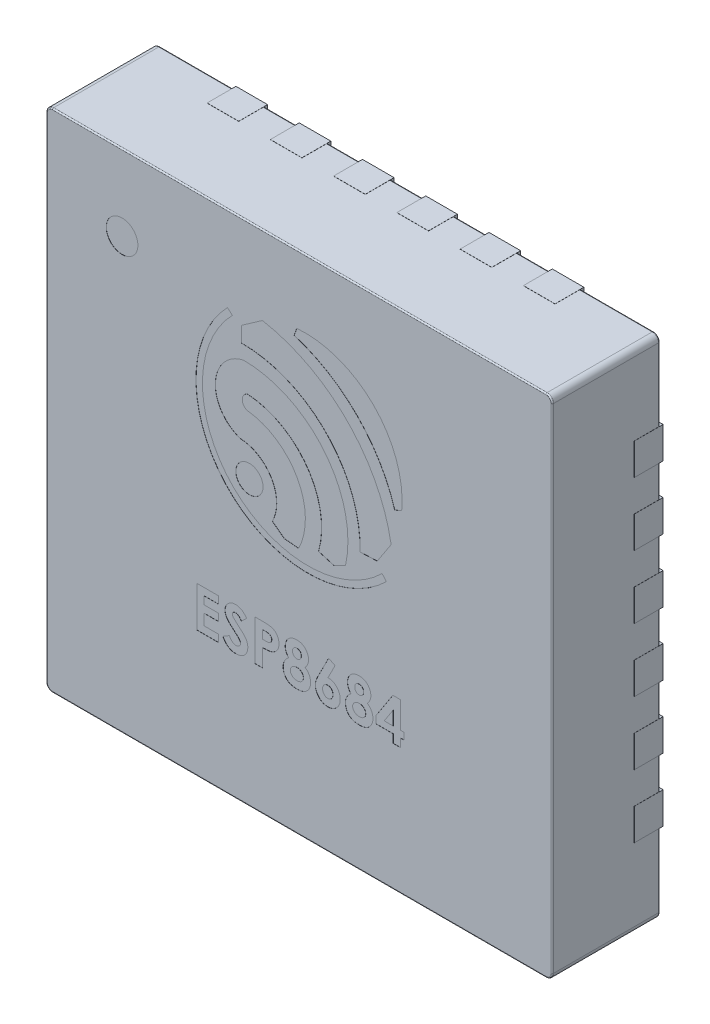
from build123d import *

# Parameters (mm, degrees)
SKETCH1_W                = 4
SKETCH1_H                = 4
BOSS_EXTRUDE1_DEPTH      = 0.85
FILLET1_R                = 0.05
FILLET2_R                = 0.01
BOSS_EXTRUDE2_DEPTH      = 0.025
BOSS_EXTRUDE2_DEPTH_BACK = 0.203
SKETCH2_W                = 0.25
SKETCH2_H                = 0.3
SKETCH2_W_2              = 0.3
SKETCH2_H_2              = 0.25
SKETCH3_R                = 0.125
SKETCH3_R_2              = 0.107472001
CUT_EXTRUDE1_DEPTH       = 0.001
BODY_MOVE_COPY1_ANGLE    = 180


with BuildPart() as part:
    # Sketch1 → Boss-Extrude1 (new body)
    with BuildSketch(Plane(origin=(0, 0, 0), x_dir=(1, 0, 0), z_dir=(0, 1, 0))):
        Rectangle(SKETCH1_W, SKETCH1_H)
    extrude(amount=BOSS_EXTRUDE1_DEPTH)

    # Fillet1
    fillet1_edges = [part.edges().sort_by_distance(p)[0] for p in [
        (2, 0.425, 2),
        (-2, 0.425, 2),
        (-2, 0.425, -2),
        (2, 0.425, -2),
    ]]
    fillet(fillet1_edges, radius=FILLET1_R)

    # Fillet2
    fillet2_edges = [part.edges().sort_by_distance(p)[0] for p in [
        (0, 0, -2),
        (0, 0.85, -2),
        (2, 0, 0),
        (0, 0, 2),
        (-2, 0, 0),
        (-1.985355339, 0, -1.985355339),
        (-1.985355339, 0, 1.985355339),
        (1.985355339, 0, 1.985355339),
        (1.985355339, 0, -1.985355339),
        (2, 0.85, 0),
        (-2, 0.85, 0),
        (0, 0.85, 2),
        (-1.985355339, 0.85, -1.985355339),
        (-1.985355339, 0.85, 1.985355339),
        (1.985355339, 0.85, 1.985355339),
        (1.985355339, 0.85, -1.985355339),
    ]]
    fillet(fillet2_edges, radius=FILLET2_R)

    # Sketch2 → Boss-Extrude2 (add, two sides: drawn at the far end of the back side and taken through both)
    with BuildSketch(Plane.XZ.offset(-BOSS_EXTRUDE2_DEPTH_BACK)):
        with BuildLine():
            Line((1.1, 1.4), (1.4, 1.1))
            Line((1.4, 1.1), (1.4, -1.35))
            ThreePointArc((1.4, -1.35), (1.385355339, -1.385355339), (1.35, -1.4))
            Line((1.35, -1.4), (-1.35, -1.4))
            ThreePointArc((-1.35, -1.4), (-1.385355339, -1.385355339), (-1.4, -1.35))
            Line((-1.4, -1.35), (-1.4, 1.35))
            ThreePointArc((-1.4, 1.35), (-1.385355339, 1.385355339), (-1.35, 1.4))
            Line((-1.35, 1.4), (1.1, 1.4))
        make_face()
        with Locations((-0.25, 1.851)):
            Rectangle(SKETCH2_W, SKETCH2_H)
        with Locations((-0.75, 1.851)):
            Rectangle(SKETCH2_W, SKETCH2_H)
        with Locations((-1.25, 1.851)):
            Rectangle(SKETCH2_W, SKETCH2_H)
        with Locations((1.25, 1.851)):
            Rectangle(SKETCH2_W, SKETCH2_H)
        with Locations((0.75, 1.851)):
            Rectangle(SKETCH2_W, SKETCH2_H)
        with Locations((0.25, 1.851)):
            Rectangle(SKETCH2_W, SKETCH2_H)
        with Locations((0.25, -1.851)):
            Rectangle(SKETCH2_W, SKETCH2_H)
        with Locations((0.75, -1.851)):
            Rectangle(SKETCH2_W, SKETCH2_H)
        with Locations((1.25, -1.851)):
            Rectangle(SKETCH2_W, SKETCH2_H)
        with Locations((-1.25, -1.851)):
            Rectangle(SKETCH2_W, SKETCH2_H)
        with Locations((-0.75, -1.851)):
            Rectangle(SKETCH2_W, SKETCH2_H)
        with Locations((-0.25, -1.851)):
            Rectangle(SKETCH2_W, SKETCH2_H)
        with Locations((1.851, 0.25)):
            Rectangle(SKETCH2_W_2, SKETCH2_H_2)
        with Locations((1.851, 0.75)):
            Rectangle(SKETCH2_W_2, SKETCH2_H_2)
        with Locations((1.851, 1.25)):
            Rectangle(SKETCH2_W_2, SKETCH2_H_2)
        with Locations((1.851, -1.25)):
            Rectangle(SKETCH2_W_2, SKETCH2_H_2)
        with Locations((1.851, -0.75)):
            Rectangle(SKETCH2_W_2, SKETCH2_H_2)
        with Locations((1.851, -0.25)):
            Rectangle(SKETCH2_W_2, SKETCH2_H_2)
        with Locations((-1.851, -0.25)):
            Rectangle(SKETCH2_W_2, SKETCH2_H_2)
        with Locations((-1.851, -0.75)):
            Rectangle(SKETCH2_W_2, SKETCH2_H_2)
        with Locations((-1.851, -1.25)):
            Rectangle(SKETCH2_W_2, SKETCH2_H_2)
        with Locations((-1.851, 1.25)):
            Rectangle(SKETCH2_W_2, SKETCH2_H_2)
        with Locations((-1.851, 0.75)):
            Rectangle(SKETCH2_W_2, SKETCH2_H_2)
        with Locations((-1.851, 0.25)):
            Rectangle(SKETCH2_W_2, SKETCH2_H_2)
    extrude(amount=BOSS_EXTRUDE2_DEPTH + BOSS_EXTRUDE2_DEPTH_BACK)

    # Sketch3 → Cut-Extrude1 (cut)
    # profile 1 of 13: a face of its own
    with BuildSketch(Plane(origin=(0, 0.85, 0), x_dir=(1, 0, 0), z_dir=(0, 1, 0))):
        with Locations(Location((1.4, -1.4, 0), (0, 0, 270))):
            Circle(SKETCH3_R)
    # profile 2 of 13: a face of its own
    with BuildSketch(Plane(origin=(0, 0.85, 0), x_dir=(1, 0, 0), z_dir=(0, 1, 0))):
        with Locations(Location((0.39345508, -0.241141571, 0), (0, 0, 270))):
            Circle(SKETCH3_R_2)
    # profile 3 of 13: a face of its own
    with BuildSketch(Plane(origin=(0, 0.85, 0), x_dir=(1, 0, 0), z_dir=(0, 1, 0))):
        with BuildLine():
            Line((-0.75484892, -0.602812328), (-0.81007292, -0.626332328))
            ThreePointArc((-0.81007292, -0.626332328), (-0.5893237, -1.23600018), (0.019198016, -1.459889505))
            Line((0.019198016, -1.459889505), (0.04024708, -1.401220328))
            ThreePointArc((0.04024708, -1.401220328), (-0.456838845, -1.101141344), (-0.75484892, -0.602812328))
        make_face()
    # profile 4 of 13: a face of its own
    with BuildSketch(Plane(origin=(0, 0.85, 0), x_dir=(1, 0, 0), z_dir=(0, 1, 0))):
        with BuildLine():
            Line((-0.480528921, -0.178899684), (-0.616632921, -0.184731684))
            Line((-0.616632921, -0.184731684), (-0.726624921, -0.352659684))
            ThreePointArc((-0.726624921, -0.352659684), (-0.37936407, -1.025536938), (0.290872644, -1.377867242))
            Line((0.290872644, -1.377867242), (0.455992644, -1.262019242))
            Line((0.455992644, -1.262019242), (0.455992644, -1.140315242))
            ThreePointArc((0.455992644, -1.140315242), (-0.215367273, -0.857447739), (-0.480528921, -0.178899684))
        make_face()
    # profile 5 of 13: a face of its own
    with BuildSketch(Plane(origin=(0, 0.85, 0), x_dir=(1, 0, 0), z_dir=(0, 1, 0))):
        with BuildLine():
            Line((0.52833508, -1.294420328), (0.56680708, -1.328452328))
            ThreePointArc((0.56680708, -1.328452328), (0.554829133, -0.084518675), (-0.689155241, -0.080361643))
            Line((-0.689155241, -0.080361643), (-0.65494165, -0.118677704))
            ThreePointArc((-0.65494165, -0.118677704), (0.518632873, -0.120883837), (0.52833508, -1.294420328))
        make_face()
    # profile 6 of 13: a face of its own
    with BuildSketch(Plane(origin=(0, 0.85, 0), x_dir=(1, 0, 0), z_dir=(0, 1, 0))):
        with BuildLine():
            Line((0.212761002, -0.04284098), (0.118057002, 0.02882302))
            Line((0.118057002, 0.02882302), (0.004345002, 0.03883102))
            ThreePointArc((0.004345002, 0.03883102), (0.014709312, -0.436766768), (0.409873248, -0.701617932))
            ThreePointArc((0.409873248, -0.701617932), (0.450103558, -0.758817334), (0.407750059, -0.814462916))
            ThreePointArc((0.407750059, -0.814462916), (-0.062895806, -0.551053312), (-0.152614131, -0.019223667))
            Line((-0.152614131, -0.019223667), (-0.272806131, 0.016560333))
            Line((-0.272806131, 0.016560333), (-0.366444513, -0.030306803))
            ThreePointArc((-0.366444513, -0.030306803), (-0.20125363, -0.724111429), (0.442201869, -1.031711667))
            ThreePointArc((0.442201869, -1.031711667), (0.66297992, -0.765895236), (0.465792913, -0.482137228))
            ThreePointArc((0.465792913, -0.482137228), (0.218503697, -0.332053753), (0.212761002, -0.04284098))
        make_face()
    # profile 7 of 13: a face of its own
    with BuildSketch(Plane(origin=(0, 0.85, 0), x_dir=(1, 0, 0), z_dir=(0, 1, 0))):
        Polygon((-0.740128205, 0.671794872), (-0.8, 0.671794872), (-0.8, 0.881025641), (-0.828717949, 0.881025641), (-0.828717949, 0.934358974), (-0.8, 0.934358974), (-0.8, 1), (-0.742564103, 1), (-0.742564103, 0.934358974), (-0.607179487, 0.934358974), (-0.607179487, 0.876217949), align=None)
        Polygon((-0.742564103, 0.881025641), (-0.742564103, 0.772115385), (-0.671730769, 0.881025641), align=None, mode=Mode.SUBTRACT)
    # profile 8 of 13: a face of its own
    with BuildSketch(Plane(origin=(0, 0.85, 0), x_dir=(1, 0, 0), z_dir=(0, 1, 0))):
        with BuildLine():
            add(Edge.make_bspline(
                [(-0.538717949, 0.827692308), (-0.542074141, 0.830089455), (-0.548717421, 0.834834392), (-0.557468605, 0.843332909), (-0.565055443, 0.852782462), (-0.571368707, 0.863152349), (-0.576412324, 0.874251167), (-0.579878411, 0.885929587), (-0.582196171, 0.898006919), (-0.582440559, 0.906228445), (-0.582564103, 0.910384615)],
                knots=[0, 0, 0, 0, 1.013470425, 2.00607327, 2.989559212, 3.987547927, 4.985093546, 5.979490292, 6.978585884, 8, 8, 8, 8], degree=3))
            add(Edge.make_bspline(
                [(-0.582564103, 0.910384615), (-0.582412391, 0.914884339), (-0.58211149, 0.923808962), (-0.579444528, 0.936895333), (-0.575185136, 0.949455647), (-0.569309229, 0.961341484), (-0.561975998, 0.972225398), (-0.553478536, 0.981937819), (-0.543690001, 0.990050179), (-0.534649917, 0.995632893), (-0.526814509, 0.999254772), (-0.52054234, 1.0017274), (-0.513811265, 1.003676431), (-0.506733579, 1.005352804), (-0.499235434, 1.006609645), (-0.491390646, 1.007599027), (-0.483125669, 1.008078834), (-0.477500458, 1.008162313), (-0.474615385, 1.008205128)],
                knots=[0, 0, 0, 0, 1.313633616, 2.605423678, 3.884827599, 5.180399172, 6.467003699, 7.709825993, 8.937691468, 10.168030689, 10.802071053, 11.45831639, 12.135866991, 12.84764728, 13.582572811, 14.35620613, 15.156926628, 16, 16, 16, 16], degree=3))
            add(Edge.make_bspline(
                [(-0.474615385, 1.008205128), (-0.471537957, 1.008163148), (-0.465528348, 1.008081169), (-0.456754724, 1.007591525), (-0.448482043, 1.006671374), (-0.440672822, 1.005513691), (-0.433398675, 1.00379457), (-0.426562966, 1.001925627), (-0.42023964, 0.999603879), (-0.412510154, 0.996022945), (-0.403550546, 0.990667537), (-0.393988316, 0.982661015), (-0.385468335, 0.973273441), (-0.378332688, 0.962437582), (-0.372386787, 0.950614067), (-0.368143374, 0.937862333), (-0.365587485, 0.924354591), (-0.36528312, 0.915096695), (-0.365128205, 0.910384615)],
                knots=[0, 0, 0, 0, 0.887187828, 1.732502891, 2.531768656, 3.28622382, 4.00645991, 4.68503301, 5.328123524, 5.945476897, 7.13918604, 8.324554323, 9.528234031, 10.780485522, 12.053158567, 13.332907357, 14.642504384, 16, 16, 16, 16], degree=3))
            add(Edge.make_bspline(
                [(-0.365128205, 0.910384615), (-0.365233905, 0.90627224), (-0.365441739, 0.898186168), (-0.367603426, 0.886384126), (-0.370899229, 0.87509621), (-0.375716063, 0.864426323), (-0.381763551, 0.854245356), (-0.389296199, 0.844762202), (-0.398056948, 0.835744715), (-0.404723911, 0.830420966), (-0.408141026, 0.827692308)],
                knots=[0, 0, 0, 0, 1.017680362, 2.001042016, 2.962316111, 3.924347734, 4.892953533, 5.888308623, 6.917664266, 8, 8, 8, 8], degree=3))
            add(Edge.make_bspline(
                [(-0.408141026, 0.827692308), (-0.406022488, 0.825250209), (-0.401851724, 0.820442452), (-0.396468705, 0.812698343), (-0.39187501, 0.804729648), (-0.388168249, 0.796489232), (-0.385187994, 0.788072094), (-0.383044248, 0.779426433), (-0.381825125, 0.770526341), (-0.381634663, 0.764512132), (-0.381538462, 0.761474359)],
                knots=[0, 0, 0, 0, 1.06167017, 2.090108827, 3.093337593, 4.079993162, 5.054811602, 6.023746282, 7.001795783, 8, 8, 8, 8], degree=3))
            add(Edge.make_bspline(
                [(-0.381538462, 0.761474359), (-0.381665014, 0.757361804), (-0.381914699, 0.749247891), (-0.384166949, 0.737371452), (-0.38782302, 0.72604707), (-0.3929808, 0.715423673), (-0.399327891, 0.705601479), (-0.407011771, 0.696918629), (-0.415805889, 0.689331367), (-0.425761962, 0.682996839), (-0.436704422, 0.677991257), (-0.448513067, 0.674393099), (-0.461133417, 0.67215933), (-0.46984098, 0.671918206), (-0.474294872, 0.671794872)],
                knots=[0, 0, 0, 0, 1.022461855, 2.017277858, 2.995792987, 3.975491763, 4.947267477, 5.896545572, 6.850353789, 7.828175386, 8.82259352, 9.83498435, 10.892601059, 12, 12, 12, 12], degree=3))
            add(Edge.make_bspline(
                [(-0.474294872, 0.671794872), (-0.478684642, 0.671918049), (-0.487243775, 0.672158219), (-0.499661798, 0.674385694), (-0.511252845, 0.678060104), (-0.522000983, 0.683131835), (-0.53181854, 0.689539996), (-0.540456563, 0.69735692), (-0.548109121, 0.706267224), (-0.554528764, 0.716321784), (-0.55969472, 0.727154763), (-0.563468463, 0.738536911), (-0.565681612, 0.750341544), (-0.565995805, 0.758345676), (-0.566153846, 0.762371795)],
                knots=[0, 0, 0, 0, 1.094374825, 2.133801765, 3.135215957, 4.120034135, 5.089936793, 6.048819145, 7.016727444, 8.011879177, 9.015716645, 10.003559944, 10.995780443, 12, 12, 12, 12], degree=3))
            add(Edge.make_bspline(
                [(-0.566153846, 0.762371795), (-0.566077238, 0.765216995), (-0.565926899, 0.770800486), (-0.564819399, 0.779027752), (-0.56294364, 0.78691715), (-0.560363898, 0.794690325), (-0.556627799, 0.802450423), (-0.551851861, 0.810572174), (-0.545778661, 0.819071618), (-0.541145644, 0.824728243), (-0.538717949, 0.827692308)],
                knots=[0, 0, 0, 0, 0.940860718, 1.84636882, 2.739437118, 3.619946589, 4.54937856, 5.582024627, 6.73298378, 8, 8, 8, 8], degree=3))
        make_face()
        with BuildLine():
            add(Edge.make_bspline(
                [(-0.472884615, 0.729230769), (-0.470520333, 0.729346888), (-0.465900772, 0.729573771), (-0.459339878, 0.731550788), (-0.453430715, 0.734790515), (-0.44833009, 0.739289252), (-0.444185974, 0.744807216), (-0.441087612, 0.751096774), (-0.439267753, 0.758125647), (-0.439074059, 0.763044866), (-0.438974359, 0.765576923)],
                knots=[0, 0, 0, 0, 1.017635784, 1.98835473, 2.924394675, 3.903775679, 4.896969949, 5.881752986, 6.909679918, 8, 8, 8, 8], degree=3))
            add(Edge.make_bspline(
                [(-0.438974359, 0.765576923), (-0.43909866, 0.768130193), (-0.439341371, 0.773115697), (-0.441208, 0.780294728), (-0.444506903, 0.786759386), (-0.448931874, 0.792419836), (-0.454171353, 0.797200444), (-0.460251099, 0.800596322), (-0.466905354, 0.802768186), (-0.471585532, 0.802972592), (-0.473974359, 0.803076923)],
                knots=[0, 0, 0, 0, 1.071109905, 2.091445327, 3.086230388, 4.096303754, 5.093673306, 6.041538876, 7.0003745, 8, 8, 8, 8], degree=3))
            add(Edge.make_bspline(
                [(-0.473974359, 0.803076923), (-0.476403089, 0.802966292), (-0.481134711, 0.802750761), (-0.487889862, 0.800697848), (-0.49391209, 0.797262265), (-0.499169047, 0.792653767), (-0.503426224, 0.786945909), (-0.506551861, 0.780377929), (-0.508352126, 0.772978587), (-0.508593025, 0.767809005), (-0.508717949, 0.765128205)],
                knots=[0, 0, 0, 0, 1.008985882, 1.965693801, 2.905634363, 3.876216071, 4.854591133, 5.849205062, 6.884658104, 8, 8, 8, 8], degree=3))
            add(Edge.make_bspline(
                [(-0.508717949, 0.765128205), (-0.508599149, 0.762594732), (-0.508369137, 0.757689577), (-0.50647008, 0.750706696), (-0.50332906, 0.744471264), (-0.49902306, 0.739060552), (-0.493664534, 0.734675564), (-0.487431682, 0.731454675), (-0.480383913, 0.729585641), (-0.475438514, 0.729351621), (-0.472884615, 0.729230769)],
                knots=[0, 0, 0, 0, 1.066147256, 2.064208482, 3.022454516, 3.989792431, 4.955788801, 5.918128389, 6.924881755, 8, 8, 8, 8], degree=3))
        make_face(mode=Mode.SUBTRACT)
        with BuildLine():
            add(Edge.make_bspline(
                [(-0.47474359, 0.860512821), (-0.472946335, 0.860541988), (-0.469403967, 0.860599476), (-0.464200183, 0.861287428), (-0.459185983, 0.862264076), (-0.454449222, 0.863785676), (-0.449864415, 0.86556319), (-0.445547294, 0.867884384), (-0.44142389, 0.870580757), (-0.437583179, 0.873653234), (-0.434110989, 0.877022288), (-0.430981409, 0.880536929), (-0.428423353, 0.884287013), (-0.426293119, 0.88814814), (-0.42458146, 0.892150842), (-0.423449925, 0.896361051), (-0.422721374, 0.900722696), (-0.422616835, 0.903693672), (-0.422564103, 0.905192308)],
                knots=[0, 0, 0, 0, 1.129662435, 2.226550525, 3.296682235, 4.33815786, 5.351414921, 6.385493299, 7.41431807, 8.4469981, 9.473537958, 10.454642902, 11.401552439, 12.321859429, 13.225429467, 14.131893492, 15.057679712, 16, 16, 16, 16], degree=3))
            add(Edge.make_bspline(
                [(-0.422564103, 0.905192308), (-0.422589354, 0.906755176), (-0.422639436, 0.909854931), (-0.423390617, 0.914380333), (-0.424480894, 0.9187407), (-0.425983666, 0.922923689), (-0.42811255, 0.926844631), (-0.430525251, 0.93065658), (-0.433440136, 0.934256051), (-0.436749964, 0.937620006), (-0.440400879, 0.940717763), (-0.444392357, 0.943395525), (-0.448640532, 0.945743065), (-0.4532077, 0.947590678), (-0.458047033, 0.948992744), (-0.463129185, 0.95000803), (-0.468486111, 0.950684896), (-0.472155959, 0.950740637), (-0.474038462, 0.950769231)],
                knots=[0, 0, 0, 0, 0.974019005, 1.931846162, 2.853358636, 3.777086404, 4.695411081, 5.630991801, 6.588726176, 7.578582455, 8.572023234, 9.570371685, 10.572628972, 11.595075622, 12.6370648, 13.711634473, 14.826148828, 16, 16, 16, 16], degree=3))
            add(Edge.make_bspline(
                [(-0.474038462, 0.950769231), (-0.475941777, 0.950734731), (-0.479650736, 0.950667502), (-0.485072487, 0.950073321), (-0.490200508, 0.949130535), (-0.495028643, 0.947782113), (-0.499575257, 0.946054793), (-0.503778976, 0.943856029), (-0.507737185, 0.941365019), (-0.511317587, 0.938451818), (-0.514579596, 0.93530863), (-0.517349958, 0.931820619), (-0.519840916, 0.928209765), (-0.521715102, 0.924243042), (-0.523320234, 0.920150825), (-0.524274244, 0.915777381), (-0.525067149, 0.911225046), (-0.525107558, 0.908080843), (-0.525128205, 0.906474359)],
                knots=[0, 0, 0, 0, 1.200730299, 2.339843079, 3.437336227, 4.487507367, 5.49914389, 6.500211663, 7.47645343, 8.445123332, 9.408146062, 10.328401978, 11.252108805, 12.168702489, 13.09034032, 14.019150537, 14.98791428, 16, 16, 16, 16], degree=3))
            add(Edge.make_bspline(
                [(-0.525128205, 0.906474359), (-0.525069529, 0.904870163), (-0.524954838, 0.901734515), (-0.524328148, 0.897103574), (-0.523149733, 0.892714991), (-0.521617282, 0.888459303), (-0.519549279, 0.884463454), (-0.517104909, 0.880605104), (-0.514117489, 0.877049743), (-0.510815194, 0.873636918), (-0.507103314, 0.870583213), (-0.503120386, 0.867904949), (-0.498972234, 0.8655481), (-0.494525442, 0.86378823), (-0.489918756, 0.862263363), (-0.485031286, 0.86128748), (-0.479955519, 0.860599319), (-0.47649818, 0.86054194), (-0.47474359, 0.860512821)],
                knots=[0, 0, 0, 0, 1.011607766, 1.977342622, 2.937803287, 3.871057497, 4.822789971, 5.768019373, 6.744124207, 7.744188914, 8.758214762, 9.766859222, 10.76764927, 11.758144632, 12.776187854, 13.822267547, 14.894806271, 16, 16, 16, 16], degree=3))
        make_face(mode=Mode.SUBTRACT)
    # profile 9 of 13: a face of its own
    with BuildSketch(Plane(origin=(0, 0.85, 0), x_dir=(1, 0, 0), z_dir=(0, 1, 0))):
        with BuildLine():
            Line((-0.232564103, 0.671794872), (-0.283397436, 0.697564103))
            Line((-0.283397436, 0.697564103), (-0.227628205, 0.807179487))
            add(Edge.make_bspline(
                [(-0.227628205, 0.807179487), (-0.230923241, 0.80726417), (-0.237413353, 0.807430965), (-0.246958074, 0.808797839), (-0.256106177, 0.811114394), (-0.264857285, 0.814347274), (-0.273273896, 0.818408867), (-0.281315152, 0.823407405), (-0.288873981, 0.829461457), (-0.296091404, 0.836181382), (-0.302655518, 0.843622674), (-0.308357262, 0.851619477), (-0.313326323, 0.859976161), (-0.317189048, 0.868879968), (-0.320304857, 0.878183232), (-0.322553049, 0.887923164), (-0.323835706, 0.898127962), (-0.324012542, 0.905060544), (-0.324102564, 0.908589744)],
                knots=[0, 0, 0, 0, 1.013301021, 1.995862538, 2.958769729, 3.911210226, 4.860765807, 5.829243184, 6.816804824, 7.835209597, 8.859810738, 9.863084768, 10.852896952, 11.844649668, 12.842374562, 13.8676291, 14.914464604, 16, 16, 16, 16], degree=3))
            add(Edge.make_bspline(
                [(-0.324102564, 0.908589744), (-0.324017918, 0.911991564), (-0.32385061, 0.918715504), (-0.322476422, 0.928593241), (-0.320229153, 0.938082401), (-0.317097899, 0.947160445), (-0.312983372, 0.955796605), (-0.308145351, 0.964125306), (-0.302234432, 0.971960527), (-0.295556241, 0.979334946), (-0.288247547, 0.986081306), (-0.280493576, 0.992012987), (-0.272329656, 0.996971307), (-0.263860684, 1.00113538), (-0.254933581, 1.004246516), (-0.245677352, 1.006593846), (-0.236023045, 1.00794859), (-0.229469903, 1.008118931), (-0.226153846, 1.008205128)],
                knots=[0, 0, 0, 0, 1.049794856, 2.07499426, 3.07172498, 4.056334273, 5.03302406, 6.020611576, 7.024540571, 8.056592197, 9.088222165, 10.090850172, 11.06486348, 12.032490482, 12.998429859, 13.977500003, 14.976563331, 16, 16, 16, 16], degree=3))
            add(Edge.make_bspline(
                [(-0.226153846, 1.008205128), (-0.222686507, 1.008133756), (-0.215868455, 1.007993414), (-0.205887736, 1.006444796), (-0.196338611, 1.004068913), (-0.187182175, 1.000842055), (-0.178532484, 0.996462257), (-0.17031572, 0.991214074), (-0.162564701, 0.984976579), (-0.155329926, 0.977936548), (-0.14881326, 0.970221842), (-0.143000587, 0.962212816), (-0.138083146, 0.953895868), (-0.13410257, 0.945280156), (-0.130996838, 0.936393066), (-0.12883588, 0.927217748), (-0.127427817, 0.917778537), (-0.127262754, 0.911372554), (-0.127179487, 0.908141026)],
                knots=[0, 0, 0, 0, 1.063729824, 2.091680771, 3.092458079, 4.082252707, 5.065066109, 6.062289472, 7.070414589, 8.114214813, 9.156632944, 10.167081891, 11.149282074, 12.117871028, 13.076366051, 14.034232288, 15.008359245, 16, 16, 16, 16], degree=3))
            add(Edge.make_bspline(
                [(-0.127179487, 0.908141026), (-0.127223482, 0.905638584), (-0.127311717, 0.900619772), (-0.128198481, 0.893104386), (-0.129546547, 0.885569224), (-0.131109534, 0.879210973), (-0.132717963, 0.873834019), (-0.134340077, 0.869284953), (-0.136328523, 0.864248864), (-0.138671857, 0.858707461), (-0.141272893, 0.852617092), (-0.144296551, 0.846049177), (-0.147644364, 0.83895133), (-0.150035882, 0.834077902), (-0.151282051, 0.831538462)],
                knots=[0, 0, 0, 0, 1.110459156, 2.227099586, 3.354645278, 4.50724841, 5.131424341, 5.845429508, 6.650417918, 7.534765369, 8.5162346, 9.590157747, 10.744282107, 12, 12, 12, 12], degree=3))
            Line((-0.151282051, 0.831538462), (-0.232564103, 0.671794872))
        make_face()
        with BuildLine():
            add(Edge.make_bspline(
                [(-0.224871795, 0.860512821), (-0.222116074, 0.860639486), (-0.216723491, 0.860887355), (-0.209052166, 0.863474266), (-0.202085544, 0.867544824), (-0.195983669, 0.873135592), (-0.190917531, 0.879915811), (-0.18722352, 0.887664619), (-0.184965748, 0.89624148), (-0.184734672, 0.902229392), (-0.184615385, 0.905320513)],
                knots=[0, 0, 0, 0, 0.981531227, 1.92072777, 2.858278205, 3.847411092, 4.856727683, 5.864107753, 6.897395173, 8, 8, 8, 8], degree=3))
            add(Edge.make_bspline(
                [(-0.184615385, 0.905320513), (-0.18476017, 0.908411157), (-0.185041786, 0.914422666), (-0.187329532, 0.923073697), (-0.191257969, 0.930897339), (-0.196583503, 0.937727121), (-0.202754355, 0.9435256), (-0.209726637, 0.94770452), (-0.217237056, 0.950295942), (-0.222437072, 0.950610378), (-0.225064103, 0.950769231)],
                knots=[0, 0, 0, 0, 1.098824389, 2.137286887, 3.15751972, 4.193305908, 5.205115386, 6.153224686, 7.067015188, 8, 8, 8, 8], degree=3))
            add(Edge.make_bspline(
                [(-0.225064103, 0.950769231), (-0.227838108, 0.950607072), (-0.233278415, 0.95028905), (-0.241126655, 0.947813318), (-0.248295106, 0.943676324), (-0.254637185, 0.938007144), (-0.26005832, 0.931241789), (-0.263876273, 0.923327473), (-0.266268631, 0.91460488), (-0.266531315, 0.908477646), (-0.266666667, 0.905320513)],
                knots=[0, 0, 0, 0, 0.969156912, 1.90068503, 2.84824055, 3.843957741, 4.860802806, 5.860356532, 6.897522282, 8, 8, 8, 8], degree=3))
            add(Edge.make_bspline(
                [(-0.266666667, 0.905320513), (-0.266526415, 0.902228354), (-0.266254554, 0.896234577), (-0.263926033, 0.887660847), (-0.260173909, 0.879892464), (-0.254964455, 0.87311314), (-0.248655727, 0.867496263), (-0.241379805, 0.863474147), (-0.233378047, 0.860880056), (-0.227755476, 0.860637316), (-0.224871795, 0.860512821)],
                knots=[0, 0, 0, 0, 1.083267085, 2.099782405, 3.092211101, 4.09231173, 5.080341908, 6.03348511, 6.991421775, 8, 8, 8, 8], degree=3))
        make_face(mode=Mode.SUBTRACT)
    # profile 10 of 13: a face of its own
    with BuildSketch(Plane(origin=(0, 0.85, 0), x_dir=(1, 0, 0), z_dir=(0, 1, 0))):
        with BuildLine():
            add(Edge.make_bspline(
                [(-0.046410256, 0.827692308), (-0.049766449, 0.830089455), (-0.056409728, 0.834834392), (-0.065160912, 0.843332909), (-0.072747751, 0.852782462), (-0.079061015, 0.863152349), (-0.084104632, 0.874251167), (-0.087570719, 0.885929587), (-0.089888479, 0.898006919), (-0.090132867, 0.906228445), (-0.09025641, 0.910384615)],
                knots=[0, 0, 0, 0, 1.013470425, 2.00607327, 2.989559212, 3.987547927, 4.985093546, 5.979490292, 6.978585884, 8, 8, 8, 8], degree=3))
            add(Edge.make_bspline(
                [(-0.09025641, 0.910384615), (-0.090104698, 0.914884339), (-0.089803798, 0.923808962), (-0.087136836, 0.936895333), (-0.082877443, 0.949455647), (-0.077001537, 0.961341484), (-0.069668305, 0.972225398), (-0.061170843, 0.981937819), (-0.051382308, 0.990050179), (-0.042342225, 0.995632893), (-0.034506816, 0.999254772), (-0.028234648, 1.0017274), (-0.021503573, 1.003676431), (-0.014425887, 1.005352804), (-0.006927742, 1.006609645), (0.000917047, 1.007599027), (0.009182024, 1.008078834), (0.014807235, 1.008162313), (0.017692308, 1.008205128)],
                knots=[0, 0, 0, 0, 1.313633616, 2.605423678, 3.884827599, 5.180399172, 6.467003699, 7.709825993, 8.937691468, 10.168030689, 10.802071053, 11.45831639, 12.135866991, 12.84764728, 13.582572811, 14.35620613, 15.156926628, 16, 16, 16, 16], degree=3))
            add(Edge.make_bspline(
                [(0.017692308, 1.008205128), (0.020769735, 1.008163148), (0.026779344, 1.008081169), (0.035552968, 1.007591525), (0.043825649, 1.006671374), (0.051634871, 1.005513691), (0.058909017, 1.00379457), (0.065744726, 1.001925627), (0.072068053, 0.999603879), (0.079797538, 0.996022945), (0.088757147, 0.990667537), (0.098319376, 0.982661015), (0.106839357, 0.973273441), (0.113975004, 0.962437582), (0.119920906, 0.950614067), (0.124164318, 0.937862333), (0.126720207, 0.924354591), (0.127024572, 0.915096695), (0.127179487, 0.910384615)],
                knots=[0, 0, 0, 0, 0.887187828, 1.732502891, 2.531768656, 3.28622382, 4.00645991, 4.68503301, 5.328123524, 5.945476897, 7.13918604, 8.324554323, 9.528234031, 10.780485522, 12.053158567, 13.332907357, 14.642504384, 16, 16, 16, 16], degree=3))
            add(Edge.make_bspline(
                [(0.127179487, 0.910384615), (0.127073788, 0.90627224), (0.126865953, 0.898186168), (0.124704266, 0.886384126), (0.121408463, 0.87509621), (0.116591629, 0.864426323), (0.110544141, 0.854245356), (0.103011493, 0.844762202), (0.094250745, 0.835744715), (0.087583782, 0.830420966), (0.084166667, 0.827692308)],
                knots=[0, 0, 0, 0, 1.017680362, 2.001042016, 2.962316111, 3.924347734, 4.892953533, 5.888308623, 6.917664266, 8, 8, 8, 8], degree=3))
            add(Edge.make_bspline(
                [(0.084166667, 0.827692308), (0.086285205, 0.825250209), (0.090455968, 0.820442452), (0.095838988, 0.812698343), (0.100432682, 0.804729648), (0.104139444, 0.796489232), (0.107119698, 0.788072094), (0.109263444, 0.779426433), (0.110482568, 0.770526341), (0.110673029, 0.764512132), (0.110769231, 0.761474359)],
                knots=[0, 0, 0, 0, 1.06167017, 2.090108827, 3.093337593, 4.079993162, 5.054811602, 6.023746282, 7.001795783, 8, 8, 8, 8], degree=3))
            add(Edge.make_bspline(
                [(0.110769231, 0.761474359), (0.110642678, 0.757361804), (0.110392994, 0.749247891), (0.108140743, 0.737371452), (0.104484672, 0.72604707), (0.099326892, 0.715423673), (0.092979801, 0.705601479), (0.085295921, 0.696918629), (0.076501803, 0.689331367), (0.066545731, 0.682996839), (0.05560327, 0.677991257), (0.043794625, 0.674393099), (0.031174275, 0.67215933), (0.022466712, 0.671918206), (0.018012821, 0.671794872)],
                knots=[0, 0, 0, 0, 1.022461855, 2.017277858, 2.995792987, 3.975491763, 4.947267477, 5.896545572, 6.850353789, 7.828175386, 8.82259352, 9.83498435, 10.892601059, 12, 12, 12, 12], degree=3))
            add(Edge.make_bspline(
                [(0.018012821, 0.671794872), (0.01362305, 0.671918049), (0.005063918, 0.672158219), (-0.007354106, 0.674385694), (-0.018945153, 0.678060104), (-0.029693291, 0.683131835), (-0.039510848, 0.689539996), (-0.048148871, 0.69735692), (-0.055801429, 0.706267224), (-0.062221072, 0.716321784), (-0.067387027, 0.727154763), (-0.071160771, 0.738536911), (-0.073373919, 0.750341544), (-0.073688113, 0.758345676), (-0.073846154, 0.762371795)],
                knots=[0, 0, 0, 0, 1.094374825, 2.133801765, 3.135215957, 4.120034135, 5.089936793, 6.048819145, 7.016727444, 8.011879177, 9.015716645, 10.003559944, 10.995780443, 12, 12, 12, 12], degree=3))
            add(Edge.make_bspline(
                [(-0.073846154, 0.762371795), (-0.073769545, 0.765216995), (-0.073619206, 0.770800486), (-0.072511706, 0.779027752), (-0.070635947, 0.78691715), (-0.068056206, 0.794690325), (-0.064320107, 0.802450423), (-0.059544169, 0.810572174), (-0.053470968, 0.819071618), (-0.048837952, 0.824728243), (-0.046410256, 0.827692308)],
                knots=[0, 0, 0, 0, 0.940860718, 1.84636882, 2.739437118, 3.619946589, 4.54937856, 5.582024627, 6.73298378, 8, 8, 8, 8], degree=3))
        make_face()
        with BuildLine():
            add(Edge.make_bspline(
                [(0.019423077, 0.729230769), (0.021787359, 0.729346888), (0.02640692, 0.729573771), (0.032967814, 0.731550788), (0.038876977, 0.734790515), (0.043977602, 0.739289252), (0.048121719, 0.744807216), (0.05122008, 0.751096774), (0.053039939, 0.758125647), (0.053233634, 0.763044866), (0.053333333, 0.765576923)],
                knots=[0, 0, 0, 0, 1.017635784, 1.98835473, 2.924394675, 3.903775679, 4.896969949, 5.881752986, 6.909679918, 8, 8, 8, 8], degree=3))
            add(Edge.make_bspline(
                [(0.053333333, 0.765576923), (0.053209032, 0.768130193), (0.052966321, 0.773115697), (0.051099692, 0.780294728), (0.047800789, 0.786759386), (0.043375818, 0.792419836), (0.038136339, 0.797200444), (0.032056594, 0.800596322), (0.025402338, 0.802768186), (0.020722161, 0.802972592), (0.018333333, 0.803076923)],
                knots=[0, 0, 0, 0, 1.071109905, 2.091445327, 3.086230388, 4.096303754, 5.093673306, 6.041538876, 7.0003745, 8, 8, 8, 8], degree=3))
            add(Edge.make_bspline(
                [(0.018333333, 0.803076923), (0.015904603, 0.802966292), (0.011172981, 0.802750761), (0.00441783, 0.800697848), (-0.001604397, 0.797262265), (-0.006861354, 0.792653767), (-0.011118531, 0.786945909), (-0.014244168, 0.780377929), (-0.016044434, 0.772978587), (-0.016285333, 0.767809005), (-0.016410256, 0.765128205)],
                knots=[0, 0, 0, 0, 1.008985882, 1.965693801, 2.905634363, 3.876216071, 4.854591133, 5.849205062, 6.884658104, 8, 8, 8, 8], degree=3))
            add(Edge.make_bspline(
                [(-0.016410256, 0.765128205), (-0.016291457, 0.762594732), (-0.016061445, 0.757689577), (-0.014162388, 0.750706696), (-0.011021368, 0.744471264), (-0.006715367, 0.739060552), (-0.001356842, 0.734675564), (0.00487601, 0.731454675), (0.011923779, 0.729585641), (0.016869178, 0.729351621), (0.019423077, 0.729230769)],
                knots=[0, 0, 0, 0, 1.066147256, 2.064208482, 3.022454516, 3.989792431, 4.955788801, 5.918128389, 6.924881755, 8, 8, 8, 8], degree=3))
        make_face(mode=Mode.SUBTRACT)
        with BuildLine():
            add(Edge.make_bspline(
                [(0.017564103, 0.860512821), (0.019361358, 0.860541988), (0.022903725, 0.860599476), (0.028107509, 0.861287428), (0.03312171, 0.862264076), (0.03785847, 0.863785676), (0.042443278, 0.86556319), (0.046760399, 0.867884384), (0.050883802, 0.870580757), (0.054724514, 0.873653234), (0.058196703, 0.877022288), (0.061326283, 0.880536929), (0.063884339, 0.884287013), (0.066014573, 0.88814814), (0.067726232, 0.892150842), (0.068857768, 0.896361051), (0.069586318, 0.900722696), (0.069690857, 0.903693672), (0.06974359, 0.905192308)],
                knots=[0, 0, 0, 0, 1.129662435, 2.226550525, 3.296682235, 4.33815786, 5.351414921, 6.385493299, 7.41431807, 8.4469981, 9.473537958, 10.454642902, 11.401552439, 12.321859429, 13.225429467, 14.131893492, 15.057679712, 16, 16, 16, 16], degree=3))
            add(Edge.make_bspline(
                [(0.06974359, 0.905192308), (0.069718339, 0.906755176), (0.069668256, 0.909854931), (0.068917075, 0.914380333), (0.067826798, 0.9187407), (0.066324026, 0.922923689), (0.064195142, 0.926844631), (0.061782442, 0.93065658), (0.058867556, 0.934256051), (0.055557729, 0.937620006), (0.051906813, 0.940717763), (0.047915336, 0.943395525), (0.04366716, 0.945743065), (0.039099992, 0.947590678), (0.034260659, 0.948992744), (0.029178507, 0.95000803), (0.023821581, 0.950684896), (0.020151734, 0.950740637), (0.018269231, 0.950769231)],
                knots=[0, 0, 0, 0, 0.974019005, 1.931846162, 2.853358636, 3.777086404, 4.695411081, 5.630991801, 6.588726176, 7.578582455, 8.572023234, 9.570371685, 10.572628972, 11.595075622, 12.6370648, 13.711634473, 14.826148828, 16, 16, 16, 16], degree=3))
            add(Edge.make_bspline(
                [(0.018269231, 0.950769231), (0.016365915, 0.950734731), (0.012656956, 0.950667502), (0.007235205, 0.950073321), (0.002107185, 0.949130535), (-0.00272095, 0.947782113), (-0.007267565, 0.946054793), (-0.011471284, 0.943856029), (-0.015429493, 0.941365019), (-0.019009894, 0.938451818), (-0.022271904, 0.93530863), (-0.025042266, 0.931820619), (-0.027533224, 0.928209765), (-0.029407409, 0.924243042), (-0.031012542, 0.920150825), (-0.031966552, 0.915777381), (-0.032759456, 0.911225046), (-0.032799866, 0.908080843), (-0.032820513, 0.906474359)],
                knots=[0, 0, 0, 0, 1.200730299, 2.339843079, 3.437336227, 4.487507367, 5.49914389, 6.500211663, 7.47645343, 8.445123332, 9.408146062, 10.328401978, 11.252108805, 12.168702489, 13.09034032, 14.019150537, 14.98791428, 16, 16, 16, 16], degree=3))
            add(Edge.make_bspline(
                [(-0.032820513, 0.906474359), (-0.032761837, 0.904870163), (-0.032647145, 0.901734515), (-0.032020456, 0.897103574), (-0.03084204, 0.892714991), (-0.029309589, 0.888459303), (-0.027241586, 0.884463454), (-0.024797217, 0.880605104), (-0.021809797, 0.877049743), (-0.018507502, 0.873636918), (-0.014795622, 0.870583213), (-0.010812694, 0.867904949), (-0.006664542, 0.8655481), (-0.00221775, 0.86378823), (0.002388936, 0.862263363), (0.007276406, 0.86128748), (0.012352173, 0.860599319), (0.015809512, 0.86054194), (0.017564103, 0.860512821)],
                knots=[0, 0, 0, 0, 1.011607766, 1.977342622, 2.937803287, 3.871057497, 4.822789971, 5.768019373, 6.744124207, 7.744188914, 8.758214762, 9.766859222, 10.76764927, 11.758144632, 12.776187854, 13.822267547, 14.894806271, 16, 16, 16, 16], degree=3))
        make_face(mode=Mode.SUBTRACT)
    # profile 11 of 13: a face of its own
    with BuildSketch(Plane(origin=(0, 0.85, 0), x_dir=(1, 0, 0), z_dir=(0, 1, 0))):
        with BuildLine():
            Line((0.348717949, 0.68), (0.284615385, 0.68))
            add(Edge.make_bspline(
                [(0.284615385, 0.68), (0.280427006, 0.680018748), (0.272346746, 0.680054917), (0.260694347, 0.680493514), (0.249944437, 0.681279505), (0.240099492, 0.682250872), (0.231163539, 0.683612668), (0.223125456, 0.685173928), (0.215983355, 0.687075778), (0.209657405, 0.689333947), (0.203978317, 0.691993911), (0.198610384, 0.694835048), (0.193634395, 0.698202775), (0.188933528, 0.701854341), (0.184543344, 0.705865713), (0.180431311, 0.710221037), (0.17663977, 0.71498361), (0.173192492, 0.72012062), (0.170063562, 0.725527482), (0.167330375, 0.731216527), (0.16511325, 0.737196031), (0.16325339, 0.743427511), (0.161759524, 0.74991064), (0.160765161, 0.756685305), (0.16008974, 0.7637042), (0.160030143, 0.768481264), (0.16, 0.770897436)],
                knots=[0, 0, 0, 0, 1.698787518, 3.27731721, 4.728409951, 6.070286353, 7.288646904, 8.393455548, 9.389990496, 10.283725379, 11.113616976, 11.931887102, 12.744353494, 13.547053751, 14.344590688, 15.153907614, 15.974148981, 16.810666655, 17.660988447, 18.506082349, 19.367288142, 20.244738011, 21.142497992, 22.06302001, 23.020302899, 24, 24, 24, 24], degree=3))
            add(Edge.make_bspline(
                [(0.16, 0.770897436), (0.160043424, 0.773570466), (0.160128758, 0.7788233), (0.160971627, 0.786521989), (0.162397293, 0.793866989), (0.164305861, 0.800889676), (0.166795321, 0.807574687), (0.169915448, 0.813878108), (0.173484446, 0.819878923), (0.17769779, 0.825467379), (0.182353548, 0.830671923), (0.187366736, 0.835549193), (0.192887776, 0.839898724), (0.198719605, 0.843946644), (0.205029088, 0.847455355), (0.211629288, 0.850704276), (0.218687604, 0.853461282), (0.223599455, 0.854907699), (0.226089744, 0.855641026)],
                knots=[0, 0, 0, 0, 1.101767505, 2.165108537, 3.187936629, 4.183892551, 5.162396277, 6.123736501, 7.080098904, 8.036826416, 9.0040019, 9.957275584, 10.916231297, 11.898534744, 12.880877694, 13.889532316, 14.930001539, 16, 16, 16, 16], degree=3))
            add(Edge.make_bspline(
                [(0.226089744, 0.855641026), (0.227730175, 0.856049168), (0.231283878, 0.856933335), (0.237164281, 0.857830986), (0.243940828, 0.858656322), (0.251635431, 0.859365598), (0.260252528, 0.85984774), (0.269783774, 0.860224272), (0.280233489, 0.860498049), (0.287499808, 0.860507764), (0.291282051, 0.860512821)],
                knots=[0, 0, 0, 0, 0.618981996, 1.340914327, 2.176866532, 3.120127938, 4.170906482, 5.338178032, 6.614476169, 8, 8, 8, 8], degree=3))
            Line((0.291282051, 0.860512821), (0.291282051, 1))
            Line((0.291282051, 1), (0.348717949, 1))
            Line((0.348717949, 1), (0.348717949, 0.68))
        make_face()
        with BuildLine():
            Line((0.291282051, 0.803076923), (0.270961538, 0.803076923))
            add(Edge.make_bspline(
                [(0.270961538, 0.803076923), (0.26726384, 0.803053564), (0.26046002, 0.803010584), (0.251169243, 0.80238575), (0.243700548, 0.801435758), (0.237806619, 0.800062127), (0.233151009, 0.798016787), (0.229183946, 0.795549895), (0.225659459, 0.792585477), (0.222721523, 0.789031602), (0.220327388, 0.785066608), (0.21864817, 0.780660557), (0.21758832, 0.775883861), (0.217487662, 0.772548556), (0.217435897, 0.770833333)],
                knots=[0, 0, 0, 0, 1.862351722, 3.426754836, 4.68713255, 5.653025869, 6.462861518, 7.236406327, 7.999926698, 8.771672214, 9.54880311, 10.322347919, 11.137246204, 12, 12, 12, 12], degree=3))
            add(Edge.make_bspline(
                [(0.217435897, 0.770833333), (0.217486048, 0.769334391), (0.217583352, 0.766426082), (0.218308023, 0.762231623), (0.219432751, 0.758329191), (0.221151679, 0.754773185), (0.223238614, 0.751480664), (0.225886151, 0.748554124), (0.228939305, 0.745898883), (0.231300435, 0.744495192), (0.2325, 0.743782051)],
                knots=[0, 0, 0, 0, 1.102449765, 2.139017612, 3.12397484, 4.080535277, 5.035673127, 5.982361139, 6.974944601, 8, 8, 8, 8], degree=3))
            add(Edge.make_bspline(
                [(0.2325, 0.743782051), (0.233515844, 0.74326831), (0.235666594, 0.742180614), (0.239329529, 0.740916088), (0.243556501, 0.739849321), (0.248376046, 0.738963915), (0.253768937, 0.738276747), (0.259734212, 0.737751236), (0.26628065, 0.737539908), (0.270833306, 0.737471524), (0.273205128, 0.737435897)],
                knots=[0, 0, 0, 0, 0.656809284, 1.390599849, 2.23162475, 3.173112763, 4.218524733, 5.370385145, 6.63003504, 8, 8, 8, 8], degree=3))
            Line((0.273205128, 0.737435897), (0.291282051, 0.737435897))
            Line((0.291282051, 0.737435897), (0.291282051, 0.803076923))
        make_face(mode=Mode.SUBTRACT)
    # profile 12 of 13: a face of its own
    with BuildSketch(Plane(origin=(0, 0.85, 0), x_dir=(1, 0, 0), z_dir=(0, 1, 0))):
        with BuildLine():
            Line((0.414358974, 0.72275641), (0.457307692, 0.762051282))
            add(Edge.make_bspline(
                [(0.457307692, 0.762051282), (0.459147077, 0.759455675), (0.46267844, 0.754472473), (0.468408164, 0.747807131), (0.474103657, 0.742083797), (0.479881369, 0.737466108), (0.485641826, 0.733748723), (0.491507412, 0.731184692), (0.497410648, 0.729535749), (0.501378794, 0.729331415), (0.503333333, 0.729230769)],
                knots=[0, 0, 0, 0, 1.299459705, 2.494781419, 3.587730629, 4.594196874, 5.512431013, 6.380462003, 7.202284646, 8, 8, 8, 8], degree=3))
            add(Edge.make_bspline(
                [(0.503333333, 0.729230769), (0.505157219, 0.7292928), (0.508678662, 0.729412566), (0.513675357, 0.730662934), (0.518165732, 0.732683462), (0.522030175, 0.735474499), (0.525139035, 0.738807807), (0.527556359, 0.742356276), (0.528961071, 0.746225276), (0.529141464, 0.748878704), (0.529230769, 0.750192308)],
                knots=[0, 0, 0, 0, 1.184157716, 2.286297433, 3.324836695, 4.370048774, 5.362957217, 6.276446515, 7.146738784, 8, 8, 8, 8], degree=3))
            add(Edge.make_bspline(
                [(0.529230769, 0.750192308), (0.529174239, 0.751524238), (0.529060396, 0.75420656), (0.527960821, 0.758137838), (0.526303449, 0.761979154), (0.524719762, 0.764317546), (0.523910256, 0.765512821)],
                knots=[0, 0, 0, 0, 0.967525499, 1.948461899, 2.951351359, 4, 4, 4, 4], degree=3))
            add(Edge.make_bspline(
                [(0.523910256, 0.765512821), (0.523171361, 0.766439131), (0.521460693, 0.768583696), (0.518297931, 0.772034597), (0.51416243, 0.776085764), (0.50922898, 0.780941323), (0.503312438, 0.786412666), (0.496539835, 0.79265821), (0.488760489, 0.799465799), (0.483310263, 0.804271646), (0.480448718, 0.806794872)],
                knots=[0, 0, 0, 0, 0.473849886, 1.097042329, 1.870584189, 2.789244661, 3.865562256, 5.093556389, 6.47402294, 8, 8, 8, 8], degree=3))
            add(Edge.make_bspline(
                [(0.480448718, 0.806794872), (0.47775631, 0.809123824), (0.472646679, 0.813543691), (0.465385903, 0.8198273), (0.458963344, 0.825455136), (0.453437413, 0.830469344), (0.448642981, 0.834663432), (0.444792096, 0.838295426), (0.441719948, 0.841206441), (0.439975328, 0.842966711), (0.439230769, 0.843717949)],
                knots=[0, 0, 0, 0, 1.543627419, 2.929484142, 4.163674036, 5.24627963, 6.164986907, 6.925413438, 7.541394495, 8, 8, 8, 8], degree=3))
            add(Edge.make_bspline(
                [(0.439230769, 0.843717949), (0.436404328, 0.846774362), (0.430970916, 0.852649863), (0.423923237, 0.861779689), (0.41806025, 0.87062336), (0.413519967, 0.879430606), (0.410227152, 0.888383437), (0.4078301, 0.897609588), (0.406393299, 0.907240975), (0.406234278, 0.913798596), (0.406153846, 0.917115385)],
                knots=[0, 0, 0, 0, 1.206413378, 2.319150186, 3.339784753, 4.27899982, 5.184598145, 6.099639703, 7.038813909, 8, 8, 8, 8], degree=3))
            add(Edge.make_bspline(
                [(0.406153846, 0.917115385), (0.406211166, 0.920347215), (0.406323629, 0.926688187), (0.407699594, 0.935967684), (0.409664444, 0.94484692), (0.412692046, 0.95323694), (0.416413207, 0.961237174), (0.420948405, 0.968850312), (0.426493138, 0.975898618), (0.432651721, 0.982572274), (0.439570238, 0.988562576), (0.447009873, 0.9938438), (0.454984791, 0.99830287), (0.46343422, 1.001977603), (0.472464128, 1.004704661), (0.481931864, 1.006766475), (0.49193282, 1.008009652), (0.498757147, 1.008139031), (0.50224359, 1.008205128)],
                knots=[0, 0, 0, 0, 1.043039441, 2.046482205, 3.024244422, 3.976033659, 4.920890471, 5.871402525, 6.830893638, 7.812473116, 8.800703348, 9.781190227, 10.754606487, 11.746997808, 12.751247331, 13.796362838, 14.874195872, 16, 16, 16, 16], degree=3))
            add(Edge.make_bspline(
                [(0.50224359, 1.008205128), (0.504980458, 1.008156627), (0.510401026, 1.008060568), (0.518389747, 1.00727471), (0.526105206, 1.006010416), (0.533531993, 1.004184346), (0.540717086, 1.001923363), (0.547582512, 0.998983277), (0.55421955, 0.995658429), (0.56060613, 0.991805468), (0.566689327, 0.987330628), (0.572644411, 0.982410528), (0.578260268, 0.976775321), (0.583751464, 0.970630442), (0.58888866, 0.963797796), (0.593942559, 0.956482985), (0.598666494, 0.948511142), (0.601585804, 0.942919956), (0.603076923, 0.940064103)],
                knots=[0, 0, 0, 0, 1.017088714, 2.014418954, 2.980620591, 3.920647918, 4.854987948, 5.776890852, 6.693269322, 7.612671471, 8.545186947, 9.498010697, 10.480815007, 11.499174288, 12.558697099, 13.655746277, 14.802607237, 16, 16, 16, 16], degree=3))
            Line((0.603076923, 0.940064103), (0.552564103, 0.90974359))
            add(Edge.make_bspline(
                [(0.552564103, 0.90974359), (0.550699068, 0.912985465), (0.547123639, 0.919200418), (0.541064739, 0.927550994), (0.534857705, 0.934701881), (0.528359036, 0.940526685), (0.521647754, 0.945103291), (0.514691442, 0.948374052), (0.507485212, 0.950398649), (0.502576655, 0.950645899), (0.500128205, 0.950769231)],
                knots=[0, 0, 0, 0, 1.283663364, 2.460892379, 3.537111102, 4.529833553, 5.449777664, 6.316464042, 7.160231139, 8, 8, 8, 8], degree=3))
            add(Edge.make_bspline(
                [(0.500128205, 0.950769231), (0.497637323, 0.950669469), (0.492804648, 0.950475916), (0.485895267, 0.948652843), (0.479532722, 0.945854668), (0.47406255, 0.941785151), (0.469417321, 0.937144719), (0.46608717, 0.931911042), (0.463927017, 0.926316306), (0.463702608, 0.92241224), (0.463589744, 0.920448718)],
                knots=[0, 0, 0, 0, 1.13537643, 2.202795631, 3.242191317, 4.290390765, 5.297919085, 6.223733717, 7.106639842, 8, 8, 8, 8], degree=3))
            add(Edge.make_bspline(
                [(0.463589744, 0.920448718), (0.463695388, 0.918622897), (0.463909995, 0.914913918), (0.465482122, 0.90939606), (0.467960459, 0.903904957), (0.470804642, 0.899353339), (0.473769855, 0.895559375), (0.476676333, 0.892321506), (0.480121011, 0.888669383), (0.484191663, 0.884702593), (0.488809115, 0.880344869), (0.493988483, 0.875606572), (0.499785544, 0.870526325), (0.503883083, 0.867065853), (0.506025641, 0.86525641)],
                knots=[0, 0, 0, 0, 0.916057066, 1.860882232, 2.859899639, 3.934694552, 4.546382938, 5.276161949, 6.118633209, 7.067046139, 8.129668089, 9.306861125, 10.591787583, 12, 12, 12, 12], degree=3))
            add(Edge.make_bspline(
                [(0.506025641, 0.86525641), (0.510098576, 0.86181009), (0.517915771, 0.85519556), (0.528964432, 0.84542804), (0.538913333, 0.8362926), (0.547696124, 0.827716155), (0.555338893, 0.819753503), (0.561925776, 0.812474548), (0.567350333, 0.805736551), (0.572975266, 0.797688812), (0.57847099, 0.788020405), (0.583141574, 0.776333549), (0.586160094, 0.764661325), (0.586499576, 0.756812066), (0.586666667, 0.752948718)],
                knots=[0, 0, 0, 0, 1.345685333, 2.582777463, 3.719355561, 4.752181389, 5.678433858, 6.502864483, 7.227563063, 7.858499643, 8.978226409, 10.023061349, 11.026965269, 12, 12, 12, 12], degree=3))
            add(Edge.make_bspline(
                [(0.586666667, 0.752948718), (0.586597141, 0.750209104), (0.586460169, 0.744811769), (0.585241972, 0.736874844), (0.583412863, 0.729219998), (0.580784321, 0.721849168), (0.577258725, 0.714845389), (0.573094351, 0.708095305), (0.568172619, 0.701619547), (0.562531791, 0.695561766), (0.556339715, 0.689993141), (0.549735264, 0.685107555), (0.542779457, 0.680976319), (0.535451201, 0.677610777), (0.527763464, 0.67498448), (0.519709144, 0.673128433), (0.511312924, 0.6720216), (0.505601647, 0.671871389), (0.502692308, 0.671794872)],
                knots=[0, 0, 0, 0, 1.010806554, 1.991397492, 2.957573065, 3.913225829, 4.872777376, 5.846906201, 6.837692339, 7.870332167, 8.898170327, 9.907899016, 10.8981826, 11.879407896, 12.8797257, 13.891947133, 14.926152479, 16, 16, 16, 16], degree=3))
            add(Edge.make_bspline(
                [(0.502692308, 0.671794872), (0.498922171, 0.671933167), (0.491411659, 0.672208666), (0.480303863, 0.67435174), (0.46944889, 0.677757507), (0.460674661, 0.681769346), (0.453753235, 0.685779514), (0.448435712, 0.689396662), (0.44298265, 0.693550388), (0.437494157, 0.69836157), (0.431762107, 0.703552091), (0.426076031, 0.709478158), (0.42015749, 0.715836136), (0.416325673, 0.720409241), (0.414358974, 0.72275641)],
                knots=[0, 0, 0, 0, 1.282890948, 2.555655204, 3.837225328, 5.149160694, 5.83044799, 6.558852598, 7.337307105, 8.162686284, 9.043076448, 9.969084596, 10.957622644, 12, 12, 12, 12], degree=3))
        make_face()
    # profile 13 of 13: a face of its own
    with BuildSketch(Plane(origin=(0, 0.85, 0), x_dir=(1, 0, 0), z_dir=(0, 1, 0))):
        Polygon((0.808205128, 0.68), (0.635897436, 0.68), (0.635897436, 0.737435897), (0.750769231, 0.737435897), (0.750769231, 0.798974359), (0.635897436, 0.798974359), (0.635897436, 0.856410256), (0.750769231, 0.856410256), (0.750769231, 0.942564103), (0.635897436, 0.942564103), (0.635897436, 1), (0.808205128, 1), align=None)
    extrude(amount=-CUT_EXTRUDE1_DEPTH, mode=Mode.SUBTRACT)


with BuildPart() as part_1:
    # Body-Move/Copy1: moved
    add(part.part.rotate(Axis((0, 0, 0), (-4.937700262164522e-15, 0.7071067811865462, 0.7071067811865488)), BODY_MOVE_COPY1_ANGLE))


with BuildPart() as part_2:
    # Body-Move/Copy2: moved
    add(part_1.part.moved(Location((0, 0, 0.025))))


solid = part_2.part
